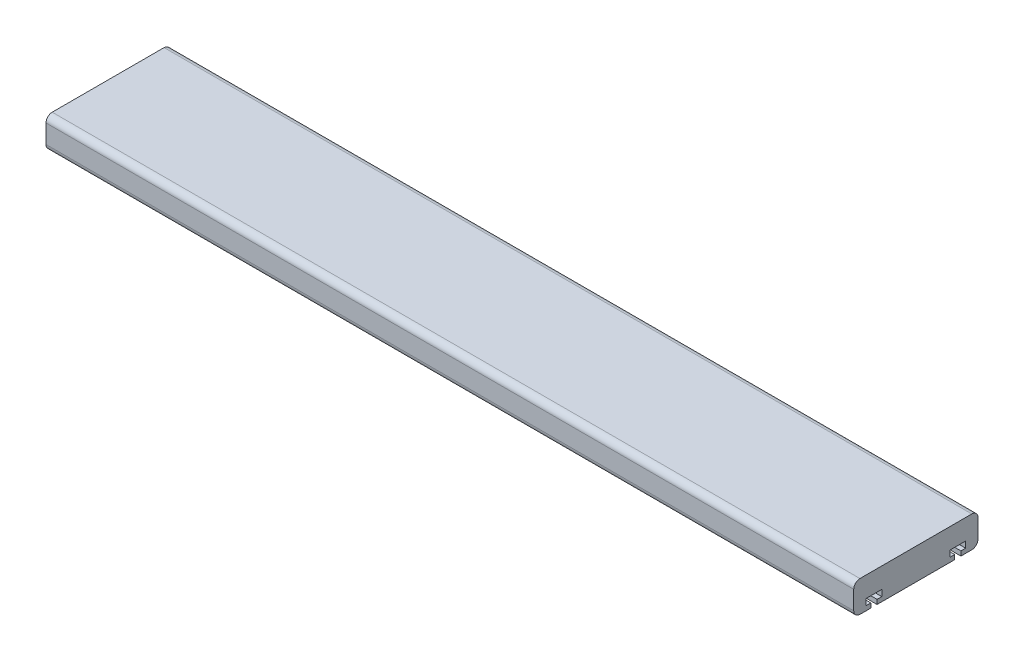
from build123d import *

# Parameters (mm, degrees)
SKETCH1_W           = 330.2
SKETCH1_H           = 12.7
BOSS_EXTRUDE1_DEPTH = 50.8
CUT_EXTRUDE1_REACH  = 336.145
FILLET1_R           = 2.54


with BuildPart() as part:
    # Sketch1 → Boss-Extrude1 (new body)
    with BuildSketch(Plane.XY):
        Rectangle(SKETCH1_W, SKETCH1_H)
    extrude(amount=BOSS_EXTRUDE1_DEPTH)

    # Sketch2 → Cut-Extrude1 (cut, up to next)
    with BuildSketch(Plane.ZY.offset(165.1), mode=Mode.PRIVATE) as cut_extrude1_sk1:
        Polygon((41.27098203, -6.35), (41.27098203, -4.509591524), (39.332279131, -4.509591524), (39.332279131, -1.969591524), (45.749684928, -1.969591524), (45.749684928, -4.509591524), (43.81098203, -4.509591524), (43.81098203, -6.35), align=None)
    cut_extrude1_tool1 = extrude(cut_extrude1_sk1.sketch, amount=-CUT_EXTRUDE1_REACH, mode=Mode.PRIVATE) & part.part
    cut_extrude1 = cut_extrude1_tool1.solids().sort_by_distance((-165.1, -3.72772, 42.540982))[0]
    add(cut_extrude1, mode=Mode.SUBTRACT)

    # Mirror1: Cut-Extrude1 across plane
    add(cut_extrude1.mirror(Plane.XY.offset(25.4)), mode=Mode.SUBTRACT)

    # Fillet1
    fillet1_edges = [part.edges().sort_by_distance(p)[0] for p in [
        (0, 6.35, 50.8),
        (0, 6.35, 0),
        (0, -6.35, 0),
        (0, -6.35, 50.8),
    ]]
    fillet(fillet1_edges, radius=FILLET1_R)


solid = part.part
